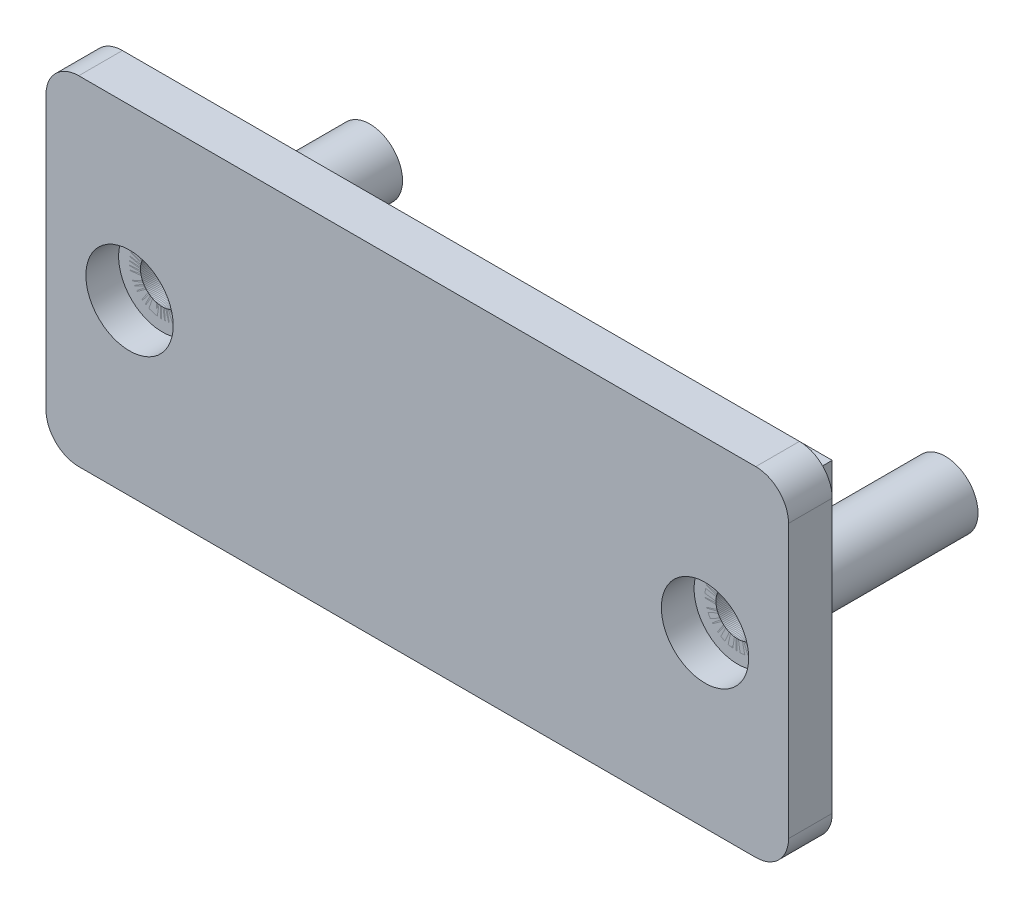
from build123d import *

# Parameters (mm, degrees)
CROQUIS3_R                 = 3
CROQUIS3_R_2               = 2
SALIENTE_EXTRUIR2_DEPTH    = 22
SALIENTE_EXTRUIR2_2_DEPTH  = 22
CROQUIS4_W                 = 62
CROQUIS4_H                 = 25
SALIENTE_EXTRUIR3_DEPTH    = 4
CROQUIS6_W                 = 62
CROQUIS6_H                 = 25
SALIENTE_EXTRUIR4_DEPTH    = 8
CORTAR_EXTRUIR1_DEPTH      = 26
CORTAR_EXTRUIR1_DEPTH_BACK = 29
CROQUIS7_R                 = 2
CROQUIS9_W                 = 62
CROQUIS9_H                 = 25
CORTAR_EXTRUIR2_DEPTH      = 4
CROQUIS10_R                = 4
CROQUIS10_R_2              = 2
CORTAR_EXTRUIR3_DEPTH      = 3


with BuildPart() as part:
    # Croquis3 → Saliente-Extruir2 (new body)
    with BuildSketch(Plane.XY):
        with Locations((26.35, 0)):
            Circle(CROQUIS3_R)
        with Locations((26.35, 0)):
            Circle(CROQUIS3_R_2, mode=Mode.SUBTRACT)
    extrude(amount=-SALIENTE_EXTRUIR2_DEPTH)


with BuildPart() as body_2:
    # Croquis3 → Saliente-Extruir2 2 (new body)
    with BuildSketch(Plane.XY):
        with Locations((-26.35, 0)):
            Circle(CROQUIS3_R)
        with Locations((-26.35, 0)):
            Circle(CROQUIS3_R_2, mode=Mode.SUBTRACT)
    extrude(amount=-SALIENTE_EXTRUIR2_2_DEPTH)


with BuildPart() as body_3:
    # Croquis4 → Saliente-Extruir3 (new body)
    with BuildSketch(Plane.XY):
        with BuildLine():
            Line((-31, 15.5), (31, 15.5))
            ThreePointArc((31, 15.5), (33.121320344, 14.621320344), (34, 12.5))
            Line((34, 12.5), (34, -12.5))
            ThreePointArc((34, -12.5), (33.121320344, -14.621320344), (31, -15.5))
            Line((31, -15.5), (-31, -15.5))
            ThreePointArc((-31, -15.5), (-33.121320344, -14.621320344), (-34, -12.5))
            Line((-34, -12.5), (-34, 12.5))
            ThreePointArc((-34, 12.5), (-33.121320344, 14.621320344), (-31, 15.5))
        make_face()
        Rectangle(CROQUIS4_W, CROQUIS4_H, mode=Mode.SUBTRACT)
    extrude(amount=-SALIENTE_EXTRUIR3_DEPTH)

    # Croquis6 → Saliente-Extruir4 (add)
    with BuildSketch(Plane.XY):
        Rectangle(CROQUIS6_W, CROQUIS6_H)
    extrude(amount=-SALIENTE_EXTRUIR4_DEPTH)

    # Croquis7 → Cortar-Extruir1 (cut, two sides: drawn at the far end of the back side and taken through both)
    with BuildSketch(Plane.XY.offset(-CORTAR_EXTRUIR1_DEPTH_BACK)):
        with Locations(Location((-26.35, 0, 0), (0, 0, 180))):
            Circle(CROQUIS7_R)
        with Locations(Location((26.35, 0, 0), (0, 0, 180))):
            Circle(CROQUIS7_R)
    extrude(amount=CORTAR_EXTRUIR1_DEPTH + CORTAR_EXTRUIR1_DEPTH_BACK, mode=Mode.SUBTRACT)

    # Croquis9 → Cortar-Extruir2 (cut)
    with BuildSketch(Plane.XY.offset(-4)):
        Rectangle(CROQUIS9_W, CROQUIS9_H)
        Polygon((-8, 11.5), (-8, -4.5), (8, -4.5), (8, 11.5), (30, 11.5), (30, -11.5), (-30, -11.5), (-30, 11.5), align=None, mode=Mode.SUBTRACT)
    extrude(amount=-CORTAR_EXTRUIR2_DEPTH, mode=Mode.SUBTRACT)


with BuildPart() as cortar_extruir3_tool:
    # Croquis10 → Cortar-Extruir3 (new body)
    # profile 1 of 2: a face of its own
    with BuildSketch(Plane.XY):
        with Locations((-26.35, 0)):
            Circle(CROQUIS10_R)
        with Locations(Location((-26.35, 0, 0), (0, 0, 180))):
            Circle(CROQUIS10_R_2, mode=Mode.SUBTRACT)
    # profile 2 of 2: a face of its own
    with BuildSketch(Plane.XY):
        with Locations((26.35, 0)):
            Circle(CROQUIS10_R)
        with Locations(Location((26.35, 0, 0), (0, 0, 180))):
            Circle(CROQUIS10_R_2, mode=Mode.SUBTRACT)
    extrude(amount=-CORTAR_EXTRUIR3_DEPTH)


with BuildPart() as part_1:
    add(part.part)

    # Cortar-Extruir3: cut by cortar_extruir3_tool
    add(cortar_extruir3_tool.part, mode=Mode.SUBTRACT)


with BuildPart() as body_2_1:
    add(body_2.part)

    # Cortar-Extruir3: cut by cortar_extruir3_tool
    add(cortar_extruir3_tool.part, mode=Mode.SUBTRACT)


with BuildPart() as body_3_1:
    add(body_3.part)

    # Cortar-Extruir3: cut by cortar_extruir3_tool
    add(cortar_extruir3_tool.part, mode=Mode.SUBTRACT)


solid = Compound([part_1.part, body_2_1.part, body_3_1.part])
